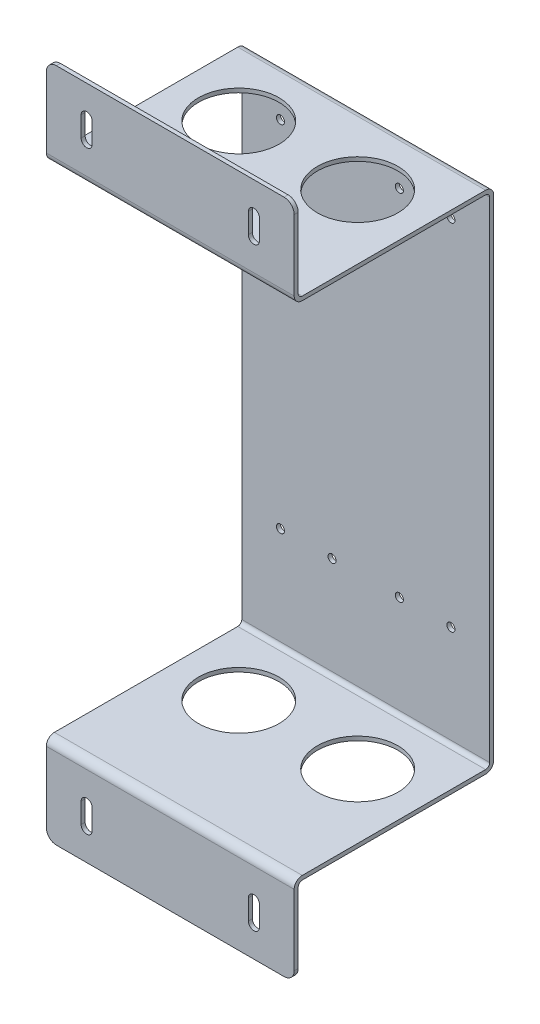
from build123d import *

# Parameters (mm, degrees)
SKETCH_1_W           = 123
SKETCH_1_H           = 335
EXTRUDE_1_DEPTH      = 99
SKETCH_2_W           = 97
SKETCH_2_H           = 247
CUT_EXTRUDE_1_DEPTH  = 214.62467086
SKETCH_3_W           = 97
SKETCH_3_H           = 42
CUT_EXTRUDE_2_DEPTH  = 214.62467086
SKETCH_4_W           = 97
SKETCH_4_H           = 42
CUT_EXTRUDE_3_DEPTH  = 214.62467086
CUT_EXTRUDE_4_DEPTH  = 238.675198538
CUT_EXTRUDE_5_DEPTH  = 237.849108084
CUT_EXTRUDE_6_DEPTH  = 238.675198538
CUT_EXTRUDE_7_DEPTH  = 237.849108084
HOLE_WIZARD_M4_1_D   = 4
HOLE_WIZARD_M4_2_D   = 4
HOLE_WIZARD_M4_3_D   = 4
HOLE_WIZARD_M4_4_D   = 4
HOLE_WIZARD_M4_5_D   = 4
HOLE_WIZARD_M4_6_D   = 4
HOLE_WIZARD_M4_7_D   = 4
HOLE_WIZARD_M4_8_D   = 4
HOLE_WIZARD_9_D      = 40
HOLE_WIZARD_9_DEPTH  = 2
HOLE_WIZARD_10_D     = 40
HOLE_WIZARD_10_DEPTH = 2
HOLE_WIZARD_11_D     = 40
HOLE_WIZARD_11_DEPTH = 293
HOLE_WIZARD_12_D     = 40
HOLE_WIZARD_12_DEPTH = 293
FILLET_1_R           = 2
FILLET_2_R           = 2
FILLET_3_R           = 2
FILLET_4_R           = 2
FILLET_5_R           = 4
FILLET_6_R           = 4
FILLET_7_R           = 4
FILLET_8_R           = 4
FILLET_9_R           = 5
FILLET_10_R          = 5
FILLET_11_R          = 5
FILLET_12_R          = 5


with BuildPart() as part:
    # 草图1 → 凸台-拉伸1 (new body)
    with BuildSketch(Plane.XY.offset(49.5)):
        with Locations((-75, 0)):
            Rectangle(SKETCH_1_W, SKETCH_1_H)
    extrude(amount=-EXTRUDE_1_DEPTH)

    # 草图2 → 切除-拉伸1 (cut, through all)
    with BuildSketch(Plane(origin=(-13.5, 0, 0), x_dir=(0, 0, -1), z_dir=(1, 0, 0))):
        with Locations((-1, 0)):
            Rectangle(SKETCH_2_W, SKETCH_2_H)
    extrude(amount=-CUT_EXTRUDE_1_DEPTH, mode=Mode.SUBTRACT)

    # 草图3 → 切除-拉伸2 (cut, through all)
    with BuildSketch(Plane(origin=(-13.5, 0, 0), x_dir=(0, 0, -1), z_dir=(1, 0, 0))):
        with Locations((1, 146.5)):
            Rectangle(SKETCH_3_W, SKETCH_3_H)
    extrude(amount=-CUT_EXTRUDE_2_DEPTH, mode=Mode.SUBTRACT)

    # 草图4 → 切除-拉伸3 (cut, through all)
    with BuildSketch(Plane(origin=(-13.5, 0, 0), x_dir=(0, 0, -1), z_dir=(1, 0, 0))):
        with Locations((1, -146.5)):
            Rectangle(SKETCH_4_W, SKETCH_4_H)
    extrude(amount=-CUT_EXTRUDE_3_DEPTH, mode=Mode.SUBTRACT)

    # 草图5 → 切除-拉伸4 (cut, through all)
    with BuildSketch(Plane.XY.offset(49.5)):
        with BuildLine():
            Line((-30.75, 142.5), (-30.75, 152.5))
            ThreePointArc((-30.75, 152.5), (-33.5, 155.25), (-36.25, 152.5))
            Line((-36.25, 152.5), (-36.25, 142.5))
            ThreePointArc((-36.25, 142.5), (-33.5, 139.75), (-30.75, 142.5))
        make_face()
    extrude(amount=-CUT_EXTRUDE_4_DEPTH, mode=Mode.SUBTRACT)

    # 草图6 → 切除-拉伸5 (cut, through all)
    with BuildSketch(Plane(origin=(0, 0, 47.5), x_dir=(-1, 0, 0), z_dir=(0, 0, -1))):
        with BuildLine():
            Line((113.75, 152.5), (113.75, 142.5))
            ThreePointArc((113.75, 142.5), (116.5, 139.75), (119.25, 142.5))
            Line((119.25, 142.5), (119.25, 152.5))
            ThreePointArc((119.25, 152.5), (116.5, 155.25), (113.75, 152.5))
        make_face()
    extrude(amount=-CUT_EXTRUDE_5_DEPTH, mode=Mode.SUBTRACT)

    # 草图7 → 切除-拉伸6 (cut, through all)
    with BuildSketch(Plane.XY.offset(49.5)):
        with BuildLine():
            Line((-30.75, -152.5), (-30.75, -142.5))
            ThreePointArc((-30.75, -142.5), (-33.5, -139.75), (-36.25, -142.5))
            Line((-36.25, -142.5), (-36.25, -152.5))
            ThreePointArc((-36.25, -152.5), (-33.5, -155.25), (-30.75, -152.5))
        make_face()
    extrude(amount=-CUT_EXTRUDE_6_DEPTH, mode=Mode.SUBTRACT)

    # 草图8 → 切除-拉伸7 (cut, through all)
    with BuildSketch(Plane(origin=(0, 0, 47.5), x_dir=(-1, 0, 0), z_dir=(0, 0, -1))):
        with BuildLine():
            Line((113.75, -142.5), (113.75, -152.5))
            ThreePointArc((113.75, -152.5), (116.5, -155.25), (119.25, -152.5))
            Line((119.25, -152.5), (119.25, -142.5))
            ThreePointArc((119.25, -142.5), (116.5, -139.75), (113.75, -142.5))
        make_face()
    extrude(amount=-CUT_EXTRUDE_7_DEPTH, mode=Mode.SUBTRACT)

    # M4 螺纹孔1 (through all)
    with Locations(Plane.XY.offset(-47.5)):
        with Locations((-117.3, -72.9)):
            Hole(HOLE_WIZARD_M4_1_D / 2)

    # M4 螺纹孔2 (through all)
    with Locations(Plane.XY.offset(-47.5)):
        with Locations((-91.7, -72.9)):
            Hole(HOLE_WIZARD_M4_2_D / 2)

    # M4 螺纹孔3 (through all)
    with Locations(Plane.XY.offset(-47.5)):
        with Locations((-32.7, -72.9)):
            Hole(HOLE_WIZARD_M4_3_D / 2)

    # M4 螺纹孔4 (through all)
    with Locations(Plane.XY.offset(-47.5)):
        with Locations((-58.3, -72.9)):
            Hole(HOLE_WIZARD_M4_4_D / 2)

    # M4 螺纹孔5 (through all)
    with Locations(Plane.XY.offset(-47.5)):
        with Locations((-91.7, 102.9)):
            Hole(HOLE_WIZARD_M4_5_D / 2)

    # M4 螺纹孔6 (through all)
    with Locations(Plane.XY.offset(-47.5)):
        with Locations((-117.3, 102.9)):
            Hole(HOLE_WIZARD_M4_6_D / 2)

    # M4 螺纹孔7 (through all)
    with Locations(Plane.XY.offset(-47.5)):
        with Locations((-32.7, 102.9)):
            Hole(HOLE_WIZARD_M4_7_D / 2)

    # M4 螺纹孔8 (through all)
    with Locations(Plane.XY.offset(-47.5)):
        with Locations((-58.3, 102.9)):
            Hole(HOLE_WIZARD_M4_8_D / 2)

    # 孔9
    with Locations(Plane.XZ.offset(125.5)):
        with Locations((-45.5, -14)):
            Hole(HOLE_WIZARD_9_D / 2, depth=HOLE_WIZARD_9_DEPTH)

    # 孔10
    with Locations(Plane.XZ.offset(125.5)):
        with Locations((-104.5, -14)):
            Hole(HOLE_WIZARD_10_D / 2, depth=HOLE_WIZARD_10_DEPTH)

    # 孔11
    with Locations(Plane(origin=(0, 125.5, 0), x_dir=(-1, 0, 0), z_dir=(0, 1, 0))):
        with Locations((104.5, -14)):
            Hole(HOLE_WIZARD_11_D / 2, depth=HOLE_WIZARD_11_DEPTH)

    # 孔12
    with Locations(Plane(origin=(0, 125.5, 0), x_dir=(-1, 0, 0), z_dir=(0, 1, 0))):
        with Locations((45.5, -14)):
            Hole(HOLE_WIZARD_12_D / 2, depth=HOLE_WIZARD_12_DEPTH)

    # 圆角1
    fillet_1_edges = [part.edges().sort_by_distance(p)[0] for p in [
        (-75, 125.5, 47.5),
    ]]
    fillet(fillet_1_edges, radius=FILLET_1_R)

    # 圆角2
    fillet_2_edges = [part.edges().sort_by_distance(p)[0] for p in [
        (-75, -125.5, 47.5),
    ]]
    fillet(fillet_2_edges, radius=FILLET_2_R)

    # 圆角3
    fillet_3_edges = [part.edges().sort_by_distance(p)[0] for p in [
        (-75, -123.5, -47.5),
    ]]
    fillet(fillet_3_edges, radius=FILLET_3_R)

    # 圆角4
    fillet_4_edges = [part.edges().sort_by_distance(p)[0] for p in [
        (-75, 123.5, -47.5),
    ]]
    fillet(fillet_4_edges, radius=FILLET_4_R)

    # 圆角5
    fillet_5_edges = [part.edges().sort_by_distance(p)[0] for p in [
        (-75, 123.5, 49.5),
    ]]
    fillet(fillet_5_edges, radius=FILLET_5_R)

    # 圆角6
    fillet_6_edges = [part.edges().sort_by_distance(p)[0] for p in [
        (-75, -123.5, 49.5),
    ]]
    fillet(fillet_6_edges, radius=FILLET_6_R)

    # 圆角7
    fillet_7_edges = [part.edges().sort_by_distance(p)[0] for p in [
        (-75, -125.5, -49.5),
    ]]
    fillet(fillet_7_edges, radius=FILLET_7_R)

    # 圆角8
    fillet_8_edges = [part.edges().sort_by_distance(p)[0] for p in [
        (-75, 125.5, -49.5),
    ]]
    fillet(fillet_8_edges, radius=FILLET_8_R)

    # 圆角9
    fillet_9_edges = [part.edges().sort_by_distance(p)[0] for p in [
        (-136.5, -167.5, 48.5),
    ]]
    fillet(fillet_9_edges, radius=FILLET_9_R)

    # 圆角10
    fillet_10_edges = [part.edges().sort_by_distance(p)[0] for p in [
        (-136.5, 167.5, 48.5),
    ]]
    fillet(fillet_10_edges, radius=FILLET_10_R)

    # 圆角11
    fillet_11_edges = [part.edges().sort_by_distance(p)[0] for p in [
        (-13.5, -167.5, 48.5),
    ]]
    fillet(fillet_11_edges, radius=FILLET_11_R)

    # 圆角12
    fillet_12_edges = [part.edges().sort_by_distance(p)[0] for p in [
        (-13.5, 167.5, 48.5),
    ]]
    fillet(fillet_12_edges, radius=FILLET_12_R)


solid = part.part
